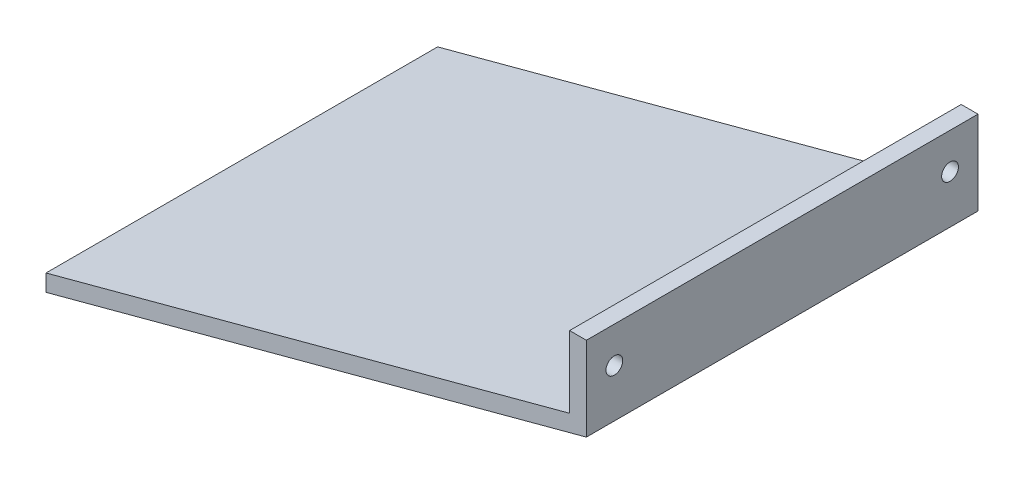
from build123d import *

# Parameters (mm, degrees)
EXTRUDE_1_DEPTH     = 70
CUT_EXTRUDE_1_REACH = 120.788
SKETCH_2_R          = 1.5


with BuildPart() as part:
    # 草图1 → 凸台-拉伸1 (new body)
    with BuildSketch(Plane.XY):
        Polygon((47.658749939, 6.237878975), (-48.93383269, -19.644025535), (-48.93383269, -16.644025535), (44.658749939, 8.434031398), (44.658749939, 21.237878975), (47.658749939, 21.237878975), (47.658749939, 9.237878975), align=None)
    extrude(amount=EXTRUDE_1_DEPTH)

    # 草图2 → 切除-拉伸1 (cut, up to next)
    with BuildSketch(Plane.ZY.offset(-44.658749939), mode=Mode.PRIVATE) as cut_extrude_1_sk1:
        with Locations(Location((5, 14.835955186, 0), (0, 0, 270))):
            Circle(SKETCH_2_R)
    cut_extrude_1_tool1 = extrude(cut_extrude_1_sk1.sketch, amount=-CUT_EXTRUDE_1_REACH, mode=Mode.PRIVATE) & part.part
    # 草图2 → 切除-拉伸1 (cut, up to next)
    with BuildSketch(Plane.ZY.offset(-44.658749939), mode=Mode.PRIVATE) as cut_extrude_1_sk2:
        with Locations(Location((65, 14.835955186, 0), (0, 0, 270))):
            Circle(SKETCH_2_R)
    cut_extrude_1_tool2 = extrude(cut_extrude_1_sk2.sketch, amount=-CUT_EXTRUDE_1_REACH, mode=Mode.PRIVATE) & part.part
    add(cut_extrude_1_tool1.solids().sort_by_distance((44.65875, 14.835955, 5))[0], mode=Mode.SUBTRACT)
    add(cut_extrude_1_tool2.solids().sort_by_distance((44.65875, 14.835955, 65))[0], mode=Mode.SUBTRACT)


solid = part.part
